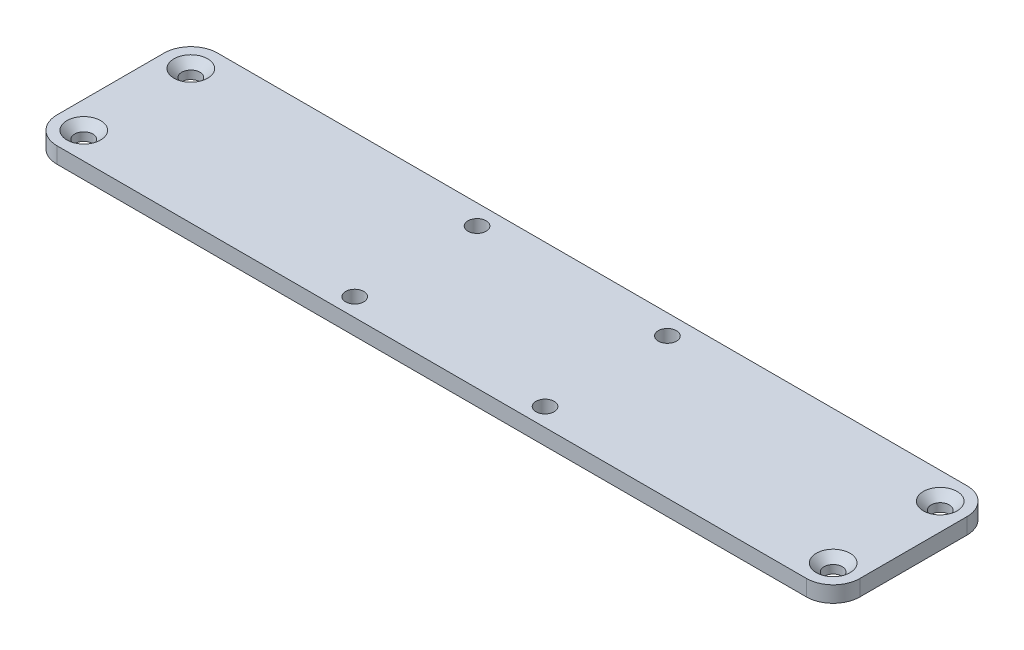
from build123d import *

# Parameters (mm, degrees)
SCHIZZO1_W                            = 150
SCHIZZO1_H                            = 30
ESTRUSIONE_ESTRUSIONE1_DEPTH          = 3
FORO_SVASATO_PER_VITE_M3_1_AT_2_COUNT = 2
FORO_SVASATO_PER_VITE_M3_1_AT_2_PITCH = 20
FORO_SVASATO_PER_VITE_M3_1_AT_3_COUNT = 2
FORO_SVASATO_PER_VITE_M3_1_AT_3_PITCH = 141.421356237
FORO_SVASATO_PER_VITE_M3_1_AT_4_COUNT = 2
FORO_SVASATO_PER_VITE_M3_1_AT_4_PITCH = 140
RACCORDO1_R                           = 5
FORO_PER_VITE_M3_1_D                  = 3.4


with BuildPart() as part:
    # Schizzo1 → Estrusione-Estrusione1 (new body)
    with BuildSketch(Plane(origin=(0, 0, 0), x_dir=(1, 0, 0), z_dir=(0, 1, 0))):
        Rectangle(SCHIZZO1_W, SCHIZZO1_H)
    extrude(amount=ESTRUSIONE_ESTRUSIONE1_DEPTH)

    # Schizzo2 → Foro svasato per Vite M3-1 (revolve, cut)
    with BuildSketch(Plane(origin=(-70, 3, -10), x_dir=(0, 0, 1), z_dir=(1, 0, 0))):
        Polygon((0, 0), (0, 3), (1.7, 3), (1.7, 1.45), (3.15, 0), align=None)
    foro_svasato_per_vite_m3_1 = revolve(axis=Axis((-70, 9.35, -10), (0, -1, 0)), mode=Mode.SUBTRACT)

    # Foro svasato per Vite M3-1 at 2: Foro svasato per Vite M3-1 ×2
    with Locations(*[(0, 0, i * FORO_SVASATO_PER_VITE_M3_1_AT_2_PITCH) for i in range(1, FORO_SVASATO_PER_VITE_M3_1_AT_2_COUNT)]):
        add(foro_svasato_per_vite_m3_1, mode=Mode.SUBTRACT)

    # Foro svasato per Vite M3-1 at 3: Foro svasato per Vite M3-1 ×2
    with Locations(*[Vector(0.9899494936611667, 0, 0.1414213562373092) * (i * FORO_SVASATO_PER_VITE_M3_1_AT_3_PITCH) for i in range(1, FORO_SVASATO_PER_VITE_M3_1_AT_3_COUNT)]):
        add(foro_svasato_per_vite_m3_1, mode=Mode.SUBTRACT)

    # Foro svasato per Vite M3-1 at 4: Foro svasato per Vite M3-1 ×2
    with Locations(*[(i * FORO_SVASATO_PER_VITE_M3_1_AT_4_PITCH, 0, 0) for i in range(1, FORO_SVASATO_PER_VITE_M3_1_AT_4_COUNT)]):
        add(foro_svasato_per_vite_m3_1, mode=Mode.SUBTRACT)

    # Raccordo1
    raccordo1_edges = [part.edges().sort_by_distance(p)[0] for p in [
        (-75, 1.5, -15),
        (75, 1.5, -15),
        (75, 1.5, 15),
        (-75, 1.5, 15),
    ]]
    fillet(raccordo1_edges, radius=RACCORDO1_R)

    # Foro per Vite M3-1 (through all)
    with Locations(Plane(origin=(0, 3, 0), x_dir=(1, 0, 0), z_dir=(0, 1, 0))):
        with Locations((17.78, -11.607048139), (-17.78, -11.607048139), (-17.78, 11.252951861), (17.78, 11.252951861)):
            Hole(FORO_PER_VITE_M3_1_D / 2)


solid = part.part
